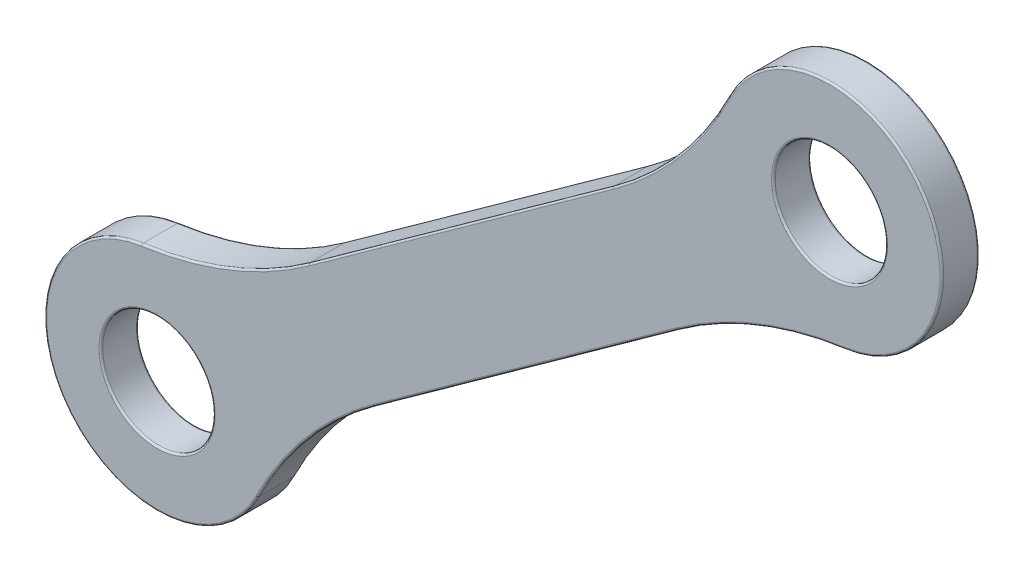
from build123d import *

# Parameters (mm, degrees)
BOSS_EXTRUDE1_DEPTH = 3
FILLET1_R           = 30
FILLET2_R           = 0.15


with BuildPart() as part:
    # Sketch1 → Boss-Extrude1 (new body)
    with BuildSketch(Plane.XY):
        with BuildLine():
            ThreePointArc((79.775032783, 130.56236121), (70.328436421, 139.551273919), (61.81935463, 129.670268829))
            Line((61.81935463, 129.670268829), (68.149825912, 134.217260509))
            ThreePointArc((68.149825912, 134.217260509), (74.429932082, 133.187568081), (73.400239654, 126.907461911))
            Line((73.400239654, 126.907461911), (67.069768371, 122.360470231))
            ThreePointArc((67.069768371, 122.360470231), (75.656252932, 123.001032633), (79.775032783, 130.56236121))
        make_face()
        with BuildLine():
            Line((61.81935463, 129.670268829), (20.635966041, 100.089449815))
            ThreePointArc((20.635966041, 100.089449815), (24.240500227, 97.137972577), (25.886379782, 92.779651217))
            Line((25.886379782, 92.779651217), (67.069768371, 122.360470231))
            ThreePointArc((67.069768371, 122.360470231), (63.465234185, 125.311947469), (61.81935463, 129.670268829))
        make_face()
        with BuildLine():
            ThreePointArc((19.555908499, 88.232659536), (13.27580233, 89.262351965), (14.305494758, 95.542458134))
            Line((14.305494758, 95.542458134), (20.635966041, 100.089449815))
            ThreePointArc((20.635966041, 100.089449815), (9.369373051, 87.006338686), (25.930701629, 91.887558835))
            ThreePointArc((25.930701629, 91.887558835), (25.919614338, 92.334155197), (25.886379782, 92.779651217))
            Line((25.886379782, 92.779651217), (19.555908499, 88.232659536))
        make_face()
        with BuildLine():
            Line((20.635966041, 100.089449815), (14.305494758, 95.542458134))
            ThreePointArc((14.305494758, 95.542458134), (20.585600928, 94.512765706), (19.555908499, 88.232659536))
            Line((19.555908499, 88.232659536), (25.886379782, 92.779651217))
            ThreePointArc((25.886379782, 92.779651217), (24.240500227, 97.137972577), (20.635966041, 100.089449815))
        make_face()
        with BuildLine():
            Line((68.149825912, 134.217260509), (61.81935463, 129.670268829))
            ThreePointArc((61.81935463, 129.670268829), (63.465234185, 125.311947469), (67.069768371, 122.360470231))
            Line((67.069768371, 122.360470231), (73.400239654, 126.907461911))
            ThreePointArc((73.400239654, 126.907461911), (67.120133484, 127.93715434), (68.149825912, 134.217260509))
        make_face()
    extrude(amount=BOSS_EXTRUDE1_DEPTH)

    # Fillet1
    fillet1_edges = [part.edges().sort_by_distance(p)[0] for p in [
        (61.81935463, 129.670268829, 1.5),
        (67.069768371, 122.360470231, 1.5),
        (25.886379782, 92.779651217, 1.5),
        (20.635966041, 100.089449815, 1.5),
    ]]
    fillet(fillet1_edges, radius=FILLET1_R)

    # Fillet2
    fillet2_edges = [part.edges().sort_by_distance(p)[0] for p in [
        (68.149825912, 134.217260509, 3),
        (9.620903031, 86.637145094, 0),
        (9.620903031, 86.637145094, 3),
        (41.227660335, 114.879859322, 0),
        (41.227660335, 114.879859322, 3),
        (46.478074076, 107.570060724, 0),
        (46.478074076, 107.570060724, 3),
        (19.555908499, 88.232659536, 3),
        (78.084831381, 135.812774952, 0),
        (78.084831381, 135.812774952, 3),
        (22.711724782, 102.661716239, 0),
        (22.711724782, 102.661716239, 3),
        (28.986832252, 93.925305349, 0),
        (28.986832252, 93.925305349, 3),
        (64.99400963, 119.788203807, 0),
        (64.99400963, 119.788203807, 3),
        (58.71890216, 128.524614697, 0),
        (58.71890216, 128.524614697, 3),
        (19.555908499, 88.232659536, 0),
        (68.149825912, 134.217260509, 0),
    ]]
    fillet(fillet2_edges, radius=FILLET2_R)


solid = part.part
